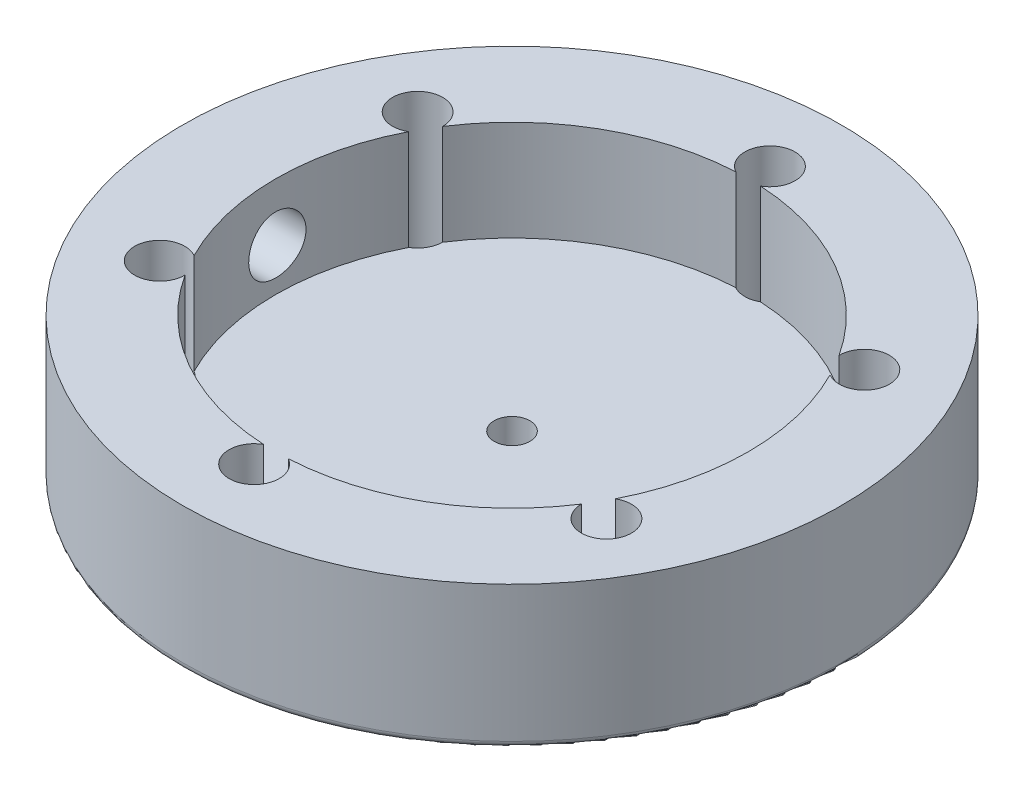
from build123d import *

# Parameters (mm, degrees)
SKETCH1_R           = 46
SKETCH1_R_2         = 3.5
BOSS_EXTRUDE1_DEPTH = 20
SKETCH2_R           = 33
CUT_EXTRUDE1_DEPTH  = 14
FILLET2_R           = 1
SKETCH3_R           = 12
BOSS_EXTRUDE2_DEPTH = 10
SKETCH4_R           = 2.5
CUT_EXTRUDE2_DEPTH  = 6
SKETCH5_R           = 5
CUT_EXTRUDE3_DEPTH  = 10
CHAMFER1_SIZE       = 1
SKETCH6_R           = 4
CUT_EXTRUDE4_DEPTH  = 69.058798176


with BuildPart() as part:
    # Sketch1 → Boss-Extrude1 (new body)
    with BuildSketch(Plane(origin=(0, 0, 0), x_dir=(1, 0, 0), z_dir=(0, 1, 0))):
        with Locations(Location((0, 0, 0), (0, 0, 270))):
            Circle(SKETCH1_R)
        with Locations(Location((0, 36, 0), (0, 0, 270))):
            Circle(SKETCH1_R_2, mode=Mode.SUBTRACT)
        with Locations(Location((-31.176914536, 18, 0), (0, 0, 270))):
            Circle(SKETCH1_R_2, mode=Mode.SUBTRACT)
        with Locations(Location((-31.176914536, -18, 0), (0, 0, 270))):
            Circle(SKETCH1_R_2, mode=Mode.SUBTRACT)
        with Locations(Location((0, -36, 0), (0, 0, 270))):
            Circle(SKETCH1_R_2, mode=Mode.SUBTRACT)
        with Locations(Location((31.176914536, -18, 0), (0, 0, 270))):
            Circle(SKETCH1_R_2, mode=Mode.SUBTRACT)
        with Locations(Location((31.176914536, 18, 0), (0, 0, 270))):
            Circle(SKETCH1_R_2, mode=Mode.SUBTRACT)
    extrude(amount=BOSS_EXTRUDE1_DEPTH)

    # Sketch2 → Cut-Extrude1 (cut)
    with BuildSketch(Plane(origin=(0, 20, 0), x_dir=(1, 0, 0), z_dir=(0, 1, 0))):
        Circle(SKETCH2_R)
    extrude(amount=-CUT_EXTRUDE1_DEPTH, mode=Mode.SUBTRACT)

    # Fillet2
    fillet2_edges = [part.edges().sort_by_distance(p)[0] for p in [
        (0, 0, -46),
    ]]
    fillet(fillet2_edges, radius=FILLET2_R)

    # Sketch3 → Boss-Extrude2 (add)
    with BuildSketch(Plane(origin=(0, 0, 0), x_dir=(-1, 0, 0), z_dir=(0, -1, 0))):
        with Locations(Location((0, 0, 0), (0, 0, 270))):
            Circle(SKETCH3_R)
    extrude(amount=BOSS_EXTRUDE2_DEPTH)

    # Sketch4 → Cut-Extrude2 (cut)
    with BuildSketch(Plane(origin=(0, 6, 0), x_dir=(1, 0, 0), z_dir=(0, 1, 0))):
        with Locations(Location((0, 0, 0), (0, 0, 270))):
            Circle(SKETCH4_R)
    extrude(amount=-CUT_EXTRUDE2_DEPTH, mode=Mode.SUBTRACT)

    # Sketch5 → Cut-Extrude3 (cut)
    with BuildSketch(Plane(origin=(0, -10, 0), x_dir=(-1, 0, 0), z_dir=(0, -1, 0))):
        with Locations(Location((0, 0, 0), (0, 0, 90))):
            Circle(SKETCH5_R)
    extrude(amount=-CUT_EXTRUDE3_DEPTH, mode=Mode.SUBTRACT)

    # Chamfer1
    chamfer1_edges = [part.edges().sort_by_distance(p)[0] for p in [
        (0, -10, 5),
    ]]
    chamfer(chamfer1_edges, length=CHAMFER1_SIZE)

    # Sketch6 → Cut-Extrude4 (cut, through all)
    with BuildSketch(Plane(origin=(0, 0, 0), x_dir=(0, 0, -1), z_dir=(1, 0, 0))):
        with Locations((0, 12)):
            Circle(SKETCH6_R)
    extrude(amount=-CUT_EXTRUDE4_DEPTH, mode=Mode.SUBTRACT)


solid = part.part
